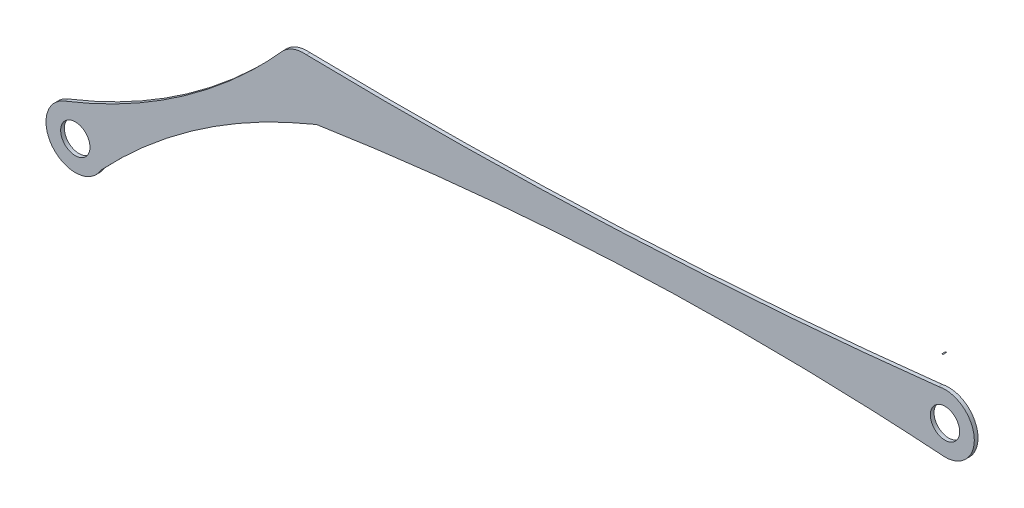
from build123d import *

# Parameters (mm, degrees)
SKETCH1_R           = 6.35
BOSS_EXTRUDE1_DEPTH = 1.6002
CUT_EXTRUDE1_DEPTH  = 324.050899169


with BuildPart() as part:
    # Sketch1 → Boss-Extrude1 (new body)
    with BuildSketch(Plane.XY):
        with BuildLine():
            Line((2.626401935, -38.912231208), (-82.119119601, -102.007437023))
            ThreePointArc((-82.119119601, -102.007437023), (-117.661054869, -96.802551105), (-112.456168951, -61.260615837))
            Line((-112.456168951, -61.260615837), (-10.589115987, 14.582007538))
            ThreePointArc((-10.589115987, 14.582007538), (-2.059055044, 17.903201209), (7.002261578, 16.605199607))
            Line((7.002261578, 16.605199607), (278.579111194, 25.386731605))
            ThreePointArc((278.579111194, 25.386731605), (304.786731605, 0.820888806), (280.220888806, -25.386731605))
            Line((280.220888806, -25.386731605), (16.974037803, -33.898910196))
            ThreePointArc((16.974037803, -33.898910196), (9.416461191, -35.307290789), (2.626401935, -38.912231208))
        make_face()
        with Locations((279.4, 0)):
            Circle(SKETCH1_R, mode=Mode.SUBTRACT)
        with Locations((-97.287644276, -81.63402643)):
            Circle(SKETCH1_R, mode=Mode.SUBTRACT)
    extrude(amount=BOSS_EXTRUDE1_DEPTH)

    # Sketch2 → Cut-Extrude1 (cut, through all)
    with BuildSketch(Plane.XY.offset(1.6002)):
        with BuildLine():
            Line((-53.969446012, -4.744671806), (-134.329544165, -73.239132517))
            ThreePointArc((-134.329544165, -73.239132517), (-125.60525441, -106.945872422), (-93.084490484, -119.382007693))
            Line((-93.084490484, -119.382007693), (5.391196219, -67.591740386))
            Line((5.391196219, -67.591740386), (280.559963716, -25.373499644))
            ThreePointArc((280.559963716, -25.373499644), (304.773499644, 1.159963716), (278.240036284, 25.373499644))
            Line((278.240036284, 25.373499644), (46.741351585, 20.654902712))
            ThreePointArc((46.741351585, 20.654902712), (10.69565429, 42.688659664), (-30.505126744, 33.346583817))
            ThreePointArc((-30.505126744, 33.346583817), (-46.196248082, 16.739687412), (-53.969446012, -4.744671806))
        make_face()
        with BuildLine():
            ThreePointArc((-102.152006015, -69.902531007), (-101.956358466, -69.823306392), (-101.759421239, -69.747344354))
            add(Edge.make_bspline(
                [(-101.759421239, -69.747344354), (-47.637210532, -48.302448827), (-8.304397238, -4.744671806)],
                knots=[0.003611947, 0.003611947, 0.003611947, 1, 1, 1], degree=2))
            ThreePointArc((-8.304397238, -4.744671806), (-4.207074532, -1.402956863), (0.895916614, -0.019268502))
            ThreePointArc((0.895916614, -0.019268502), (1.85975658, -0.002755052), (2.822072535, -0.059395822))
            add(Edge.make_bspline(
                [(2.822072535, -0.059395822), (140.13746109, -2.856877681), (276.581108414, 12.383208398)],
                knots=[0.010068083, 0.010068083, 0.010068083, 0.989878349, 0.989878349, 0.989878349], degree=2))
            ThreePointArc((276.581108414, 12.383208398), (277.981681745, 12.620553606), (279.4, 12.7))
            ThreePointArc((279.4, 12.7), (292.1, 0), (279.4, -12.7))
            ThreePointArc((279.4, -12.7), (278.533255688, -12.670388877), (277.670553151, -12.58169359))
            add(Edge.make_bspline(
                [(7.343872653, -24.024450777), (141.939870387, -3.391503831), (277.670553151, -12.58169359)],
                knots=[0, 0, 0, 0.993669622, 0.993669622, 0.993669622], degree=2))
            ThreePointArc((7.343872653, -24.024450777), (6.384059671, -24.462532684), (5.391196219, -24.819434467))
            add(Edge.make_bspline(
                [(5.391196219, -24.819434467), (-47.371168783, -46.53348503), (-86.207298162, -87.840146796)],
                knots=[0.018124898, 0.018124898, 0.018124898, 1, 1, 1], degree=2))
            ThreePointArc((-86.207298162, -87.840146796), (-106.779700454, -90.071494623), (-102.152006015, -69.902531007))
        make_face(mode=Mode.SUBTRACT)
    extrude(amount=-CUT_EXTRUDE1_DEPTH, mode=Mode.SUBTRACT)


with BuildPart() as cut_extrude1_piece_1:
    # of the separate pieces the step leaves, piece 1, a body of its own (cut_extrude1_pieces)
    add(part.part.solids().sort_by_distance((277.670553151, -12.58169359, 0))[0])


with BuildPart() as cut_extrude1_piece_2:
    # of the separate pieces the step leaves, piece 2, a body of its own (cut_extrude1_pieces)
    add(part.part.solids().sort_by_distance((278.050297658, 25.369632235, 0))[0])


solid = Compound([cut_extrude1_piece_1.part, cut_extrude1_piece_2.part])
